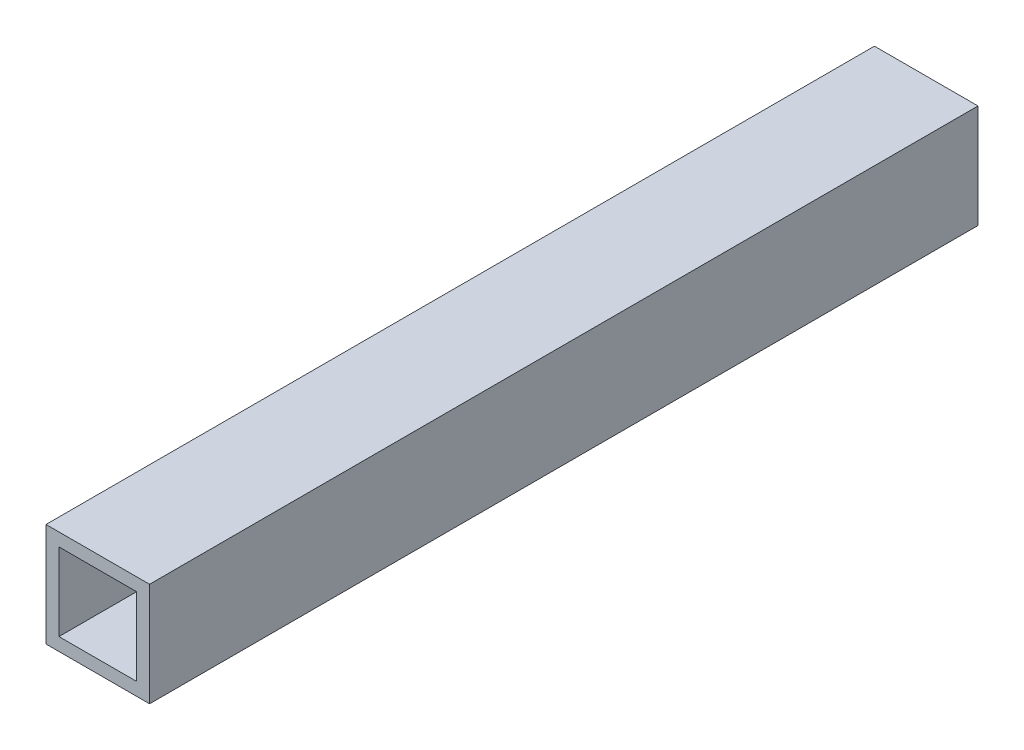
from build123d import *

# Parameters (mm, degrees)
SKETCH1_W           = 25.4
SKETCH1_H           = 25.4
SKETCH1_W_2         = 19.05
SKETCH1_H_2         = 19.05
EXTRUDE_THIN1_DEPTH = 203.2


with BuildPart() as part:
    # Sketch1 → Extrude-Thin1 (new body)
    with BuildSketch(Plane.XY):
        with Locations((-12.7, 12.7)):
            Rectangle(SKETCH1_W, SKETCH1_H)
        with Locations((-12.7, 12.7)):
            Rectangle(SKETCH1_W_2, SKETCH1_H_2, mode=Mode.SUBTRACT)
    extrude(amount=EXTRUDE_THIN1_DEPTH)


solid = part.part
